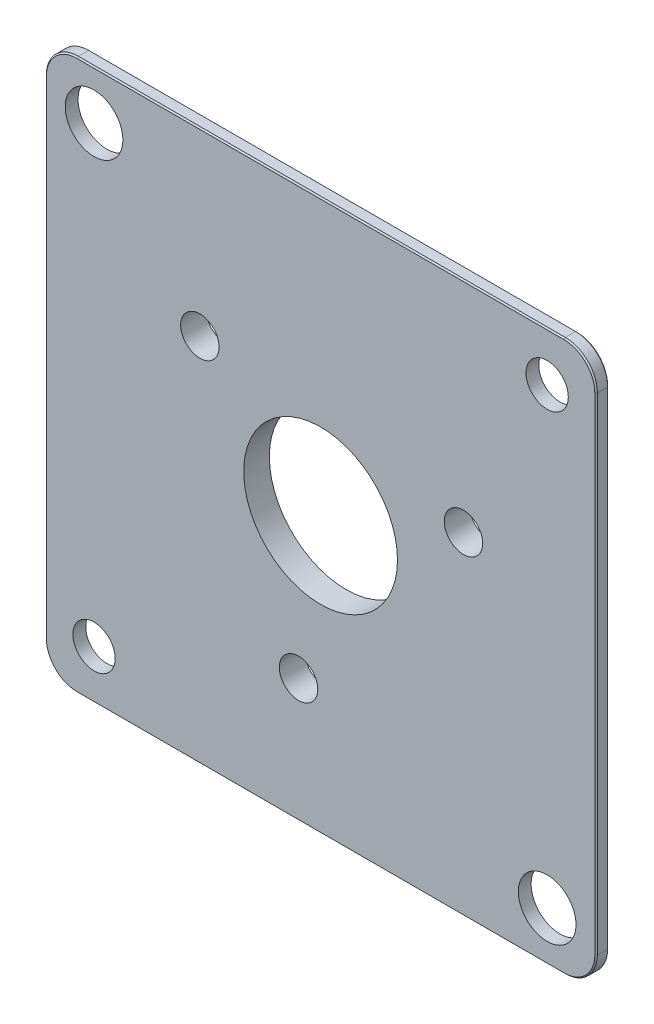
from build123d import *

# Parameters (mm, degrees)
SKETCH1_W           = 43
SKETCH1_H           = 43
SKETCH1_R           = 2.25
SKETCH1_R_2         = 1.65
BOSS_EXTRUDE1_DEPTH = 0.5
SKETCH2_R           = 6
CUT_EXTRUDE1_DEPTH  = 1
FILLET1_R           = 2.5
CHAMFER1_SIZE       = 0.1
SKETCH3_R           = 1.5
CUT_EXTRUDE2_DEPTH  = 31.42203149
SKETCH4_R           = 16
SKETCH4_R_2         = 6
SKETCH4_R_3         = 1.5
BOSS_EXTRUDE2_DEPTH = 1


with BuildPart() as part:
    # Sketch1 → Boss-Extrude1 (new, symmetric)
    with BuildSketch(Plane.XY):
        Rectangle(SKETCH1_W, SKETCH1_H)
        with Locations((-17.68, 17.68)):
            Circle(SKETCH1_R, mode=Mode.SUBTRACT)
        with Locations((17.68, -17.68)):
            Circle(SKETCH1_R, mode=Mode.SUBTRACT)
        with Locations((17.68, 17.68)):
            Circle(SKETCH1_R_2, mode=Mode.SUBTRACT)
        with Locations((-17.68, -17.68)):
            Circle(SKETCH1_R_2, mode=Mode.SUBTRACT)
    extrude(amount=BOSS_EXTRUDE1_DEPTH, both=True)

    # Sketch2 → Cut-Extrude1 (cut)
    with BuildSketch(Plane.XY.offset(0.5)):
        Circle(SKETCH2_R)
    extrude(amount=-CUT_EXTRUDE1_DEPTH, mode=Mode.SUBTRACT)

    # Fillet1
    fillet1_edges = [part.edges().sort_by_distance(p)[0] for p in [
        (21.5, -21.5, 0),
        (-21.5, -21.5, 0),
        (-21.5, 21.5, 0),
        (21.5, 21.5, 0),
    ]]
    fillet(fillet1_edges, radius=FILLET1_R)

    # Chamfer1
    chamfer1_edges = [part.edges().sort_by_distance(p)[0] for p in [
        (0, -21.5, -0.5),
        (0, -21.5, 0.5),
        (21.5, 0, -0.5),
        (-21.5, 0, -0.5),
        (0, 21.5, -0.5),
        (-20.767766953, 20.767766953, -0.5),
        (20.767766953, 20.767766953, -0.5),
        (20.767766953, -20.767766953, -0.5),
        (-20.767766953, -20.767766953, -0.5),
        (-21.5, 0, 0.5),
        (21.5, 0, 0.5),
        (0, 21.5, 0.5),
        (-20.767766953, 20.767766953, 0.5),
        (20.767766953, 20.767766953, 0.5),
        (20.767766953, -20.767766953, 0.5),
        (-20.767766953, -20.767766953, 0.5),
    ]]
    chamfer(chamfer1_edges, length=CHAMFER1_SIZE)

    # Sketch3 → Cut-Extrude2 (cut, through all)
    with BuildSketch(Plane.XY.offset(0.5)):
        with Locations((-9.42, 7.43)):
            Circle(SKETCH3_R)
        with Locations((11.15, 4.45)):
            Circle(SKETCH3_R)
        with Locations((-1.72, -11.85)):
            Circle(SKETCH3_R)
    extrude(amount=-CUT_EXTRUDE2_DEPTH, mode=Mode.SUBTRACT)

    # Sketch4 → Boss-Extrude2 (add)
    with BuildSketch(Plane(origin=(0, 0, -0.5), x_dir=(-1, 0, 0), z_dir=(0, 0, -1))):
        Circle(SKETCH4_R)
        with Locations(Location((0, 0, 0), (0, 0, 180))):
            Circle(SKETCH4_R_2, mode=Mode.SUBTRACT)
        with Locations(Location((-11.15, 4.45, 0), (0, 0, 180))):
            Circle(SKETCH4_R_3, mode=Mode.SUBTRACT)
        with Locations(Location((9.42, 7.43, 0), (0, 0, 180))):
            Circle(SKETCH4_R_3, mode=Mode.SUBTRACT)
        with Locations(Location((1.72, -11.85, 0), (0, 0, 180))):
            Circle(SKETCH4_R_3, mode=Mode.SUBTRACT)
    extrude(amount=BOSS_EXTRUDE2_DEPTH)


solid = part.part
